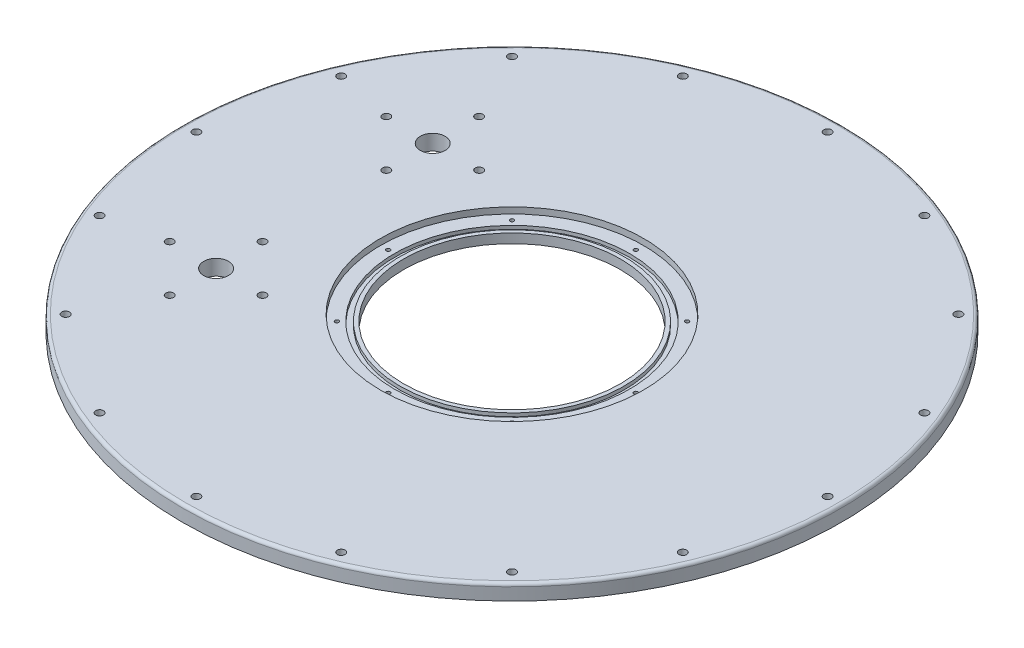
from build123d import *

# Parameters (mm, degrees)
SKETCH_1_R               = 195
EXTRUDE_1_DEPTH          = 10
SKETCH_3_R               = 213
SKETCH_3_R_2             = 195
EXTRUDE_2_DEPTH          = 10
HOLE_WIZARD_M6_1_D       = 5
PATTERN_CIRCULAR_1_COUNT = 16
SKETCH_6_R               = 70
CUT_EXTRUDE_2_DEPTH      = 10
SKETCH_7_R               = 85
CUT_EXTRUDE_3_DEPTH      = 4
SKETCH_9_R               = 76
SKETCH_9_R_2             = 72.5
CUT_EXTRUDE_5_DEPTH      = 2.2
HOLE_WIZARD_M3_2_D       = 2.5
HOLE_WIZARD_M3_2_DEPTH   = 3
HOLE_WIZARD_M3_2_TIP     = 0.751075774
FILLET_1_R               = 2
HOLE_WIZARD_M3_3_D       = 3
HOLE_WIZARD_M3_3_DEPTH   = 3
HOLE_WIZARD_M3_3_TIP     = 0.901290929
SKETCH_33_R              = 8
CUT_EXTRUDE_6_DEPTH      = 10
PATTERN_CIRCULAR_2_COUNT = 4


with BuildPart() as part:
    # 草图1 → 凸台-拉伸1 (new body)
    with BuildSketch(Plane(origin=(0, 0, 0), x_dir=(1, 0, 0), z_dir=(0, 1, 0))):
        Circle(SKETCH_1_R)
    extrude(amount=EXTRUDE_1_DEPTH)

    # 草图3 → 凸台-拉伸2 (add)
    with BuildSketch(Plane.XZ):
        Circle(SKETCH_3_R)
        Circle(SKETCH_3_R_2, mode=Mode.SUBTRACT)
    extrude(amount=-EXTRUDE_2_DEPTH)

    # M6 螺纹孔1 (through all)
    with Locations(Plane(origin=(0, 0, 204), x_dir=(0, 0, -1), z_dir=(0, -1, 0))):
        with Locations((0, 0)):
            hole_wizard_m6_1 = Hole(HOLE_WIZARD_M6_1_D / 2)

    # 阵列(圆周)1: M6 螺纹孔1 ×16 about axis
    pattern_circular_1_axis = Axis((0, 0, 0), (0, -1, 0))
    for i in range(1, PATTERN_CIRCULAR_1_COUNT):
        add(hole_wizard_m6_1.rotate(pattern_circular_1_axis, i * 360 / PATTERN_CIRCULAR_1_COUNT), mode=Mode.SUBTRACT)

    # 草图6 → 切除-拉伸2 (cut)
    with BuildSketch(Plane(origin=(0, 10, 0), x_dir=(1, 0, 0), z_dir=(0, 1, 0))):
        Circle(SKETCH_6_R)
    extrude(amount=-CUT_EXTRUDE_2_DEPTH, mode=Mode.SUBTRACT)

    # 草图7 → 切除-拉伸3 (cut)
    with BuildSketch(Plane(origin=(0, 10, 0), x_dir=(1, 0, 0), z_dir=(0, 1, 0))):
        Circle(SKETCH_7_R)
    extrude(amount=-CUT_EXTRUDE_3_DEPTH, mode=Mode.SUBTRACT)

    # 草图9 → 切除-拉伸5 (cut)
    with BuildSketch(Plane(origin=(0, 6, 0), x_dir=(1, 0, 0), z_dir=(0, 1, 0))):
        Circle(SKETCH_9_R)
        Circle(SKETCH_9_R_2, mode=Mode.SUBTRACT)
    extrude(amount=-CUT_EXTRUDE_5_DEPTH, mode=Mode.SUBTRACT)

    # M3 螺纹孔2
    with Locations(Plane(origin=(0, 6, 80), x_dir=(0, 0, 1), z_dir=(0, 1, 0))):
        with Locations((0, 0), (-23.431457505, 56.568542495), (-80, 80), (-136.568542495, 56.568542495), (-160, 0), (-136.568542495, -56.568542495), (-80, -80), (-23.431457505, -56.568542495)):
            Hole(HOLE_WIZARD_M3_2_D / 2, depth=HOLE_WIZARD_M3_2_DEPTH)
            with Locations((0, 0, -(HOLE_WIZARD_M3_2_DEPTH + HOLE_WIZARD_M3_2_TIP / 2))):  # 118° drill point
                Cone(0, HOLE_WIZARD_M3_2_D / 2, HOLE_WIZARD_M3_2_TIP, mode=Mode.SUBTRACT)

    # 圆角1
    fillet_1_edges = [part.edges().sort_by_distance(p)[0] for p in [
        (-213, 10, 0),
    ]]
    fillet(fillet_1_edges, radius=FILLET_1_R)

    # M3 螺纹孔3
    with Locations(Plane(origin=(125, 0, -125), x_dir=(0, 0, -1), z_dir=(0, -1, 0))):
        with Locations((0, 0), (0, -50), (0, -100), (0, -150), (0, -200), (0, -250), (-50, 0), (-50, -50), (-100, 0), (-50, -200), (-100, -250), (-150, -250), (-200, -200), (-250, -200), (-250, -250), (-250, -50), (-250, -100), (-250, -150), (-250, 0), (-200, 0), (-200, -50), (-150, 0)):
            Hole(HOLE_WIZARD_M3_3_D / 2, depth=HOLE_WIZARD_M3_3_DEPTH)
            with Locations((0, 0, -(HOLE_WIZARD_M3_3_DEPTH + HOLE_WIZARD_M3_3_TIP / 2))):  # 118° drill point
                Cone(0, HOLE_WIZARD_M3_3_D / 2, HOLE_WIZARD_M3_3_TIP, mode=Mode.SUBTRACT)

    # 草图33 → 切除-拉伸6 (cut)
    with BuildSketch(Plane(origin=(0, 10, 0), x_dir=(1, 0, 0), z_dir=(0, 1, 0))):
        with Locations((-121.24355653, -70)):
            Circle(SKETCH_33_R)
    cut_extrude_6 = extrude(amount=-CUT_EXTRUDE_6_DEPTH, mode=Mode.SUBTRACT)

    # 草图37 → M6 螺纹孔3 (revolve, cut)
    with BuildSketch(Plane(origin=(-121.24355653, 10, 100), x_dir=(0, 0, 1), z_dir=(1, 0, 0))):
        Polygon((0, 0), (0, 8.002151548), (2.5, 6.5), (2.5, 0), align=None)
    hole_wizard_m6_3 = revolve(axis=Axis((-121.24355653, 16.35, 100), (0, -1, 0)), mode=Mode.SUBTRACT)

    # 阵列(圆周)2: M6 螺纹孔3 ×4 about axis
    pattern_circular_2_axis = Axis((-121.24355653, 0, 70), (0, 1, 0))
    for i in range(1, PATTERN_CIRCULAR_2_COUNT):
        add(hole_wizard_m6_3.rotate(pattern_circular_2_axis, i * 360 / PATTERN_CIRCULAR_2_COUNT), mode=Mode.SUBTRACT)

    # 镜向1: 切除-拉伸6, M6 螺纹孔3 across plane
    add(cut_extrude_6.mirror(Plane.XY), mode=Mode.SUBTRACT)
    add(hole_wizard_m6_3.mirror(Plane.XY), mode=Mode.SUBTRACT)

    # 镜向1 copy 1 sketch → 镜向1 copy 1 (revolve, cut)
    with BuildSketch(Plane(origin=(-91.24355653, 10, -70), x_dir=(1, 0, 0), z_dir=(0, 0, 1))):
        Polygon((0, 0), (0, -8.002151548), (2.5, -6.5), (2.5, 0), align=None)
    revolve(axis=Axis((-91.24355653, 16.35, -70), (0, 1, 0)), mode=Mode.SUBTRACT)

    # 镜向1 copy 2 sketch → 镜向1 copy 2 (revolve, cut)
    with BuildSketch(Plane(origin=(-121.24355653, 10, -40), x_dir=(0, 0, 1), z_dir=(-1, 0, 0))):
        Polygon((0, 0), (0, -8.002151548), (2.5, -6.5), (2.5, 0), align=None)
    revolve(axis=Axis((-121.24355653, 16.35, -40), (0, 1, 0)), mode=Mode.SUBTRACT)

    # 镜向1 copy 3 sketch → 镜向1 copy 3 (revolve, cut)
    with BuildSketch(Plane(origin=(-151.24355653, 10, -70), x_dir=(-1, 0, 0), z_dir=(0, 0, -1))):
        Polygon((0, 0), (0, -8.002151548), (2.5, -6.5), (2.5, 0), align=None)
    revolve(axis=Axis((-151.24355653, 16.35, -70), (0, 1, 0)), mode=Mode.SUBTRACT)


solid = part.part
